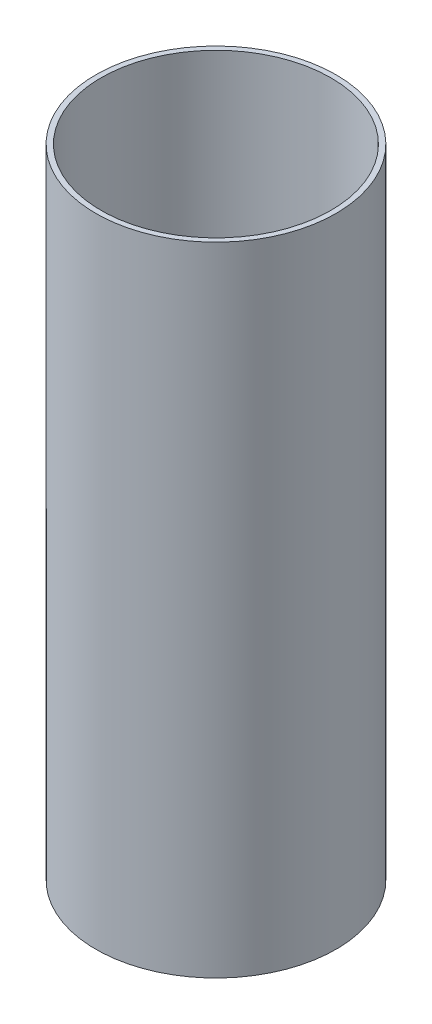
from build123d import *

# Parameters (mm, degrees)
EXTRUDE_START       = 69.25
SKETCH_1_R          = 11.5
EXTRUDE_1_DEPTH     = 61
CUT_EXTRUDE_START   = 69.25
SKETCH_2_R          = 11
CUT_EXTRUDE_1_DEPTH = 61


with BuildPart() as part:
    # 草图1 → 凸台-拉伸1 (new body)
    with BuildSketch(Plane(origin=(0, 0, 0), x_dir=(1, 0, 0), z_dir=(0, 1, 0)).offset(EXTRUDE_START)):
        with Locations(Location((0, -141, 0), (0, 0, 90))):
            Circle(SKETCH_1_R)
    extrude(amount=EXTRUDE_1_DEPTH)

    # 草图2 → 切除-拉伸1 (cut)
    with BuildSketch(Plane(origin=(0, 0, 0), x_dir=(1, 0, 0), z_dir=(0, 1, 0)).offset(CUT_EXTRUDE_START)):
        with Locations(Location((0, -141, 0), (0, 0, 90))):
            Circle(SKETCH_2_R)
    extrude(amount=CUT_EXTRUDE_1_DEPTH, mode=Mode.SUBTRACT)


solid = part.part
